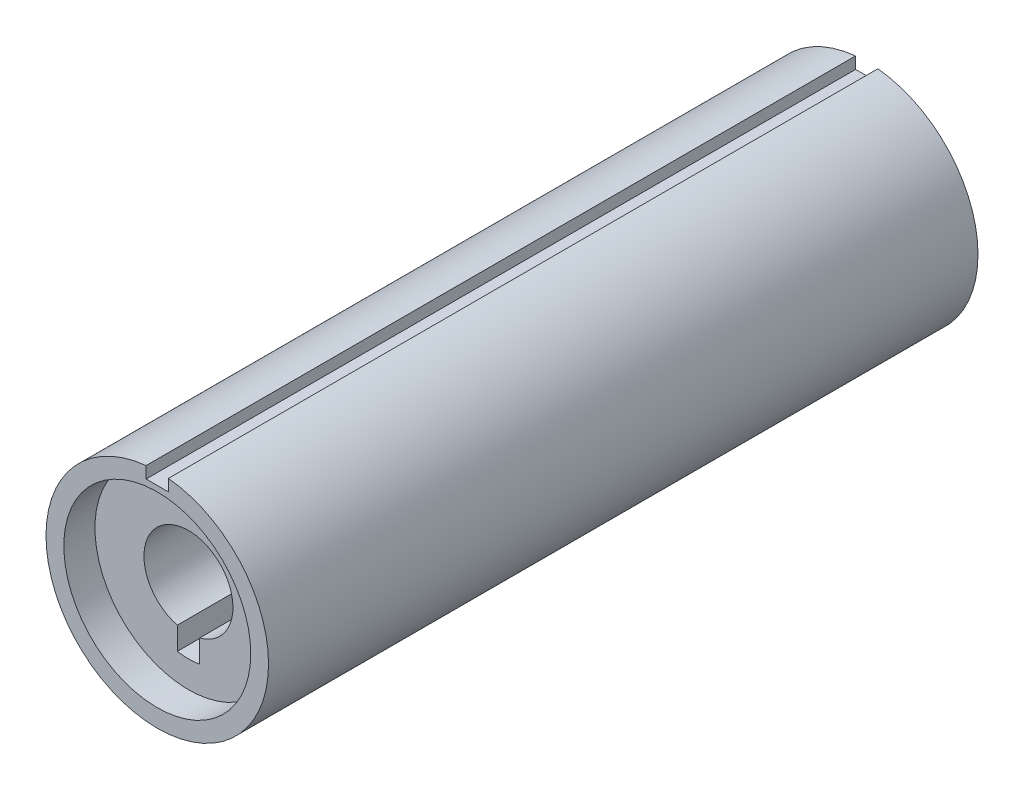
from build123d import *

# Parameters (mm, degrees)
BOSS_EXTRUDE1_DEPTH = 152.4
SKETCH3_R           = 21
BOSS_EXTRUDE2_DEPTH = 7
BOSS_EXTRUDE3_START = -152.4
BOSS_EXTRUDE3_DEPTH = 152.4


with BuildPart() as part:
    # Sketch1 → Boss-Extrude1 (new body)
    with BuildSketch(Plane.XY):
        with BuildLine():
            Line((-2.5, 22.25), (-2.5, 24.874685928))
            ThreePointArc((-2.5, 24.874685928), (-25, 0), (-2.5, -24.874685928))
            Line((-2.5, -24.874685928), (-2.5, -9.682458366))
            ThreePointArc((-2.5, -9.682458366), (0, 10), (2.5, -9.682458366))
            Line((2.5, -9.682458366), (2.5, -24.874685928))
            ThreePointArc((2.5, -24.874685928), (25, 0), (2.5, 24.874685928))
            Line((2.5, 24.874685928), (2.5, 22.25))
            Line((2.5, 22.25), (-2.5, 22.25))
        make_face()
    extrude(amount=BOSS_EXTRUDE1_DEPTH)

    # Sketch3 → Boss-Extrude2 (add)
    with BuildSketch(Plane.XY.offset(152.4)):
        with BuildLine():
            Line((-2.5, 22.25), (2.5, 22.25))
            Line((2.5, 22.25), (2.5, 24.874685928))
            ThreePointArc((2.5, 24.874685928), (24.874685928, -2.5), (-2.5, -24.874685928))
            ThreePointArc((-2.5, -24.874685928), (-25, 0), (-2.5, 24.874685928))
            Line((-2.5, 24.874685928), (-2.5, 22.25))
        make_face()
        with Locations(Location((0, 0, 0), (0, 0, 263.162858832))):
            Circle(SKETCH3_R, mode=Mode.SUBTRACT)
    extrude(amount=BOSS_EXTRUDE2_DEPTH)

    # Sketch4 → Boss-Extrude3 (add)
    with BuildSketch(Plane.XY.offset(152.4).offset(BOSS_EXTRUDE3_START)):
        with BuildLine():
            Line((-2.5, -14.790199458), (-2.5, -24.874685928))
            ThreePointArc((-2.5, -24.874685928), (0, -25), (2.5, -24.874685928))
            Line((2.5, -24.874685928), (2.5, -14.790199458))
            ThreePointArc((2.5, -14.790199458), (0, -15), (-2.5, -14.790199458))
        make_face()
    extrude(amount=BOSS_EXTRUDE3_DEPTH)


solid = part.part
